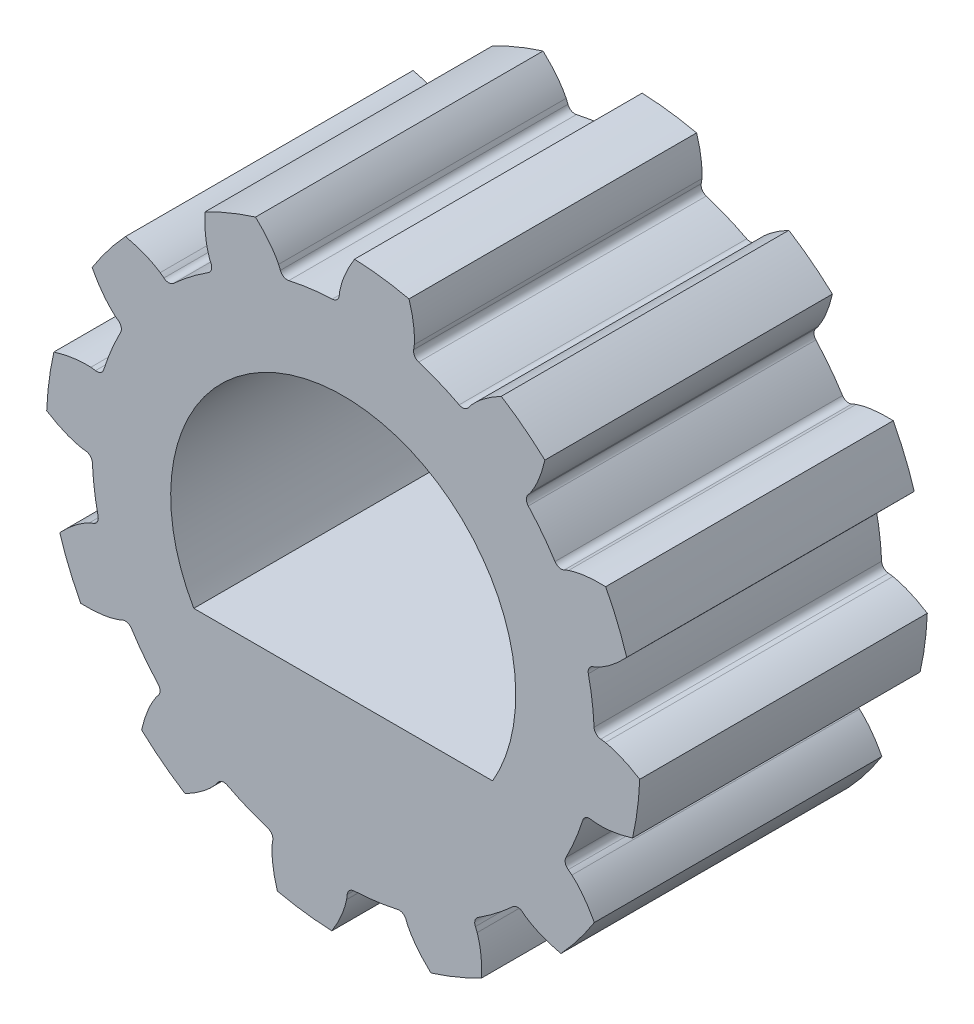
from build123d import *

# Parameters (mm, degrees)
BOSS_EXTRUDE1_DEPTH      = 2.5
BOSS_EXTRUDE1_DEPTH_BACK = 2.5
SKETCH3_R                = 4.365625
SKETCH3_R_2              = 3.571875
BOSS_EXTRUDE2_DEPTH      = 2.5
FILLET1_R                = 0.127
CIRPATTERN1_COUNT        = 12
FILLET1_OF_CIRPATTERN1_R = 0.127
SKETCH5_R                = 3.96875
BOSS_EXTRUDE3_DEPTH      = 2.5


with BuildPart() as part:
    # Sketch3 → Boss-Extrude1 (new, two sides: drawn at the far end of the back side and taken through both)
    with BuildSketch(Plane.XY.offset(-BOSS_EXTRUDE1_DEPTH_BACK)):
        Circle(SKETCH3_R)
        Circle(SKETCH3_R_2, mode=Mode.SUBTRACT)
    extrude(amount=BOSS_EXTRUDE1_DEPTH + BOSS_EXTRUDE1_DEPTH_BACK)

    # Sketch4 → Boss-Extrude2 (add, symmetric)
    with BuildSketch(Plane.XY):
        with BuildLine():
            ThreePointArc((0.058079, -4.5581), (0.069936, -4.461935), (0.070986, -4.365048))
            Line((0.070986, -4.365048), (-1.198325, -4.19794))
            ThreePointArc((-1.198325, -4.19794), (-1.222387, -4.291798), (-1.235823, -4.387755))
            add(Edge.make_bspline(
                [(-1.144054, -5.030933), (-1.153678, -4.999768), (-1.214072, -4.79045), (-1.247243, -4.573119), (-1.235823, -4.387755)],
                knots=[0.845099, 0.845099, 0.845099, 0.845099, 0.8683, 1, 1, 1, 1], degree=3))
            ThreePointArc((-1.144054, -5.030933), (-0.673434, -5.115236), (-0.19703, -5.155611))
            add(Edge.make_bspline(
                [(-0.19703, -5.155611), (-0.179668, -5.127999), (-0.067156, -4.941444), (0.021134, -4.740105), (0.058079, -4.5581)],
                knots=[0.845099, 0.845099, 0.845099, 0.845099, 0.8683, 1, 1, 1, 1], degree=3))
        make_face()
    boss_extrude2 = extrude(amount=BOSS_EXTRUDE2_DEPTH, both=True)

    # Fillet1
    fillet1_edges = [part.edges().sort_by_distance(p)[0] for p in [
        (0.070986, -4.365048, 0),
        (-1.198325, -4.19794, 0),
    ]]
    fillet(fillet1_edges, radius=FILLET1_R)

    # CirPattern1: Boss-Extrude2 ×12 about axis
    cirpattern1_axis = Axis((0, 0, -2.5), (0, 0, 1))
    for i in range(1, CIRPATTERN1_COUNT):
        add(boss_extrude2.rotate(cirpattern1_axis, i * 360 / CIRPATTERN1_COUNT))

    # Fillet1 of CirPattern1
    fillet1_of_cirpattern1_edges = [part.edges().sort_by_distance(p)[0] for p in [
        (2.244, -3.744749, 0),
        (1.06119, -4.234685, 0),
        (3.815735, -2.121048, 0),
        (3.03636, -3.13675, 0),
        (4.365048, 0.070986, 0),
        (4.19794, -1.198325, 0),
        (3.744749, 2.244, 0),
        (4.234685, 1.06119, 0),
        (2.121048, 3.815735, 0),
        (3.13675, 3.03636, 0),
        (-0.070986, 4.365048, 0),
        (1.198325, 4.19794, 0),
        (-2.244, 3.744749, 0),
        (-1.06119, 4.234685, 0),
        (-3.815735, 2.121048, 0),
        (-3.03636, 3.13675, 0),
        (-4.365048, -0.070986, 0),
        (-4.19794, 1.198325, 0),
        (-3.744749, -2.244, 0),
        (-4.234685, -1.06119, 0),
        (-2.121048, -3.815735, 0),
        (-3.13675, -3.03636, 0),
    ]]
    fillet(fillet1_of_cirpattern1_edges, radius=FILLET1_OF_CIRPATTERN1_R)

    # Sketch5 → Boss-Extrude3 (add, symmetric)
    # profile 1 of 2: a face of its own
    with BuildSketch(Plane.XY):
        Circle(SKETCH5_R)
        with BuildLine():
            ThreePointArc((2.598076, -1.5), (0, -3), (-2.598076, -1.5))
            ThreePointArc((-2.598076, -1.5), (-0.776457, 2.897777), (3, 0))
            ThreePointArc((3, 0), (2.897777, -0.776457), (2.598076, -1.5))
        make_face(mode=Mode.SUBTRACT)
    # profile 2 of 2: a face of its own
    with BuildSketch(Plane.XY):
        with BuildLine():
            Line((2.598076, -1.5), (-2.598076, -1.5))
            ThreePointArc((-2.598076, -1.5), (0, -3), (2.598076, -1.5))
        make_face()
    extrude(amount=BOSS_EXTRUDE3_DEPTH, both=True)


solid = part.part
